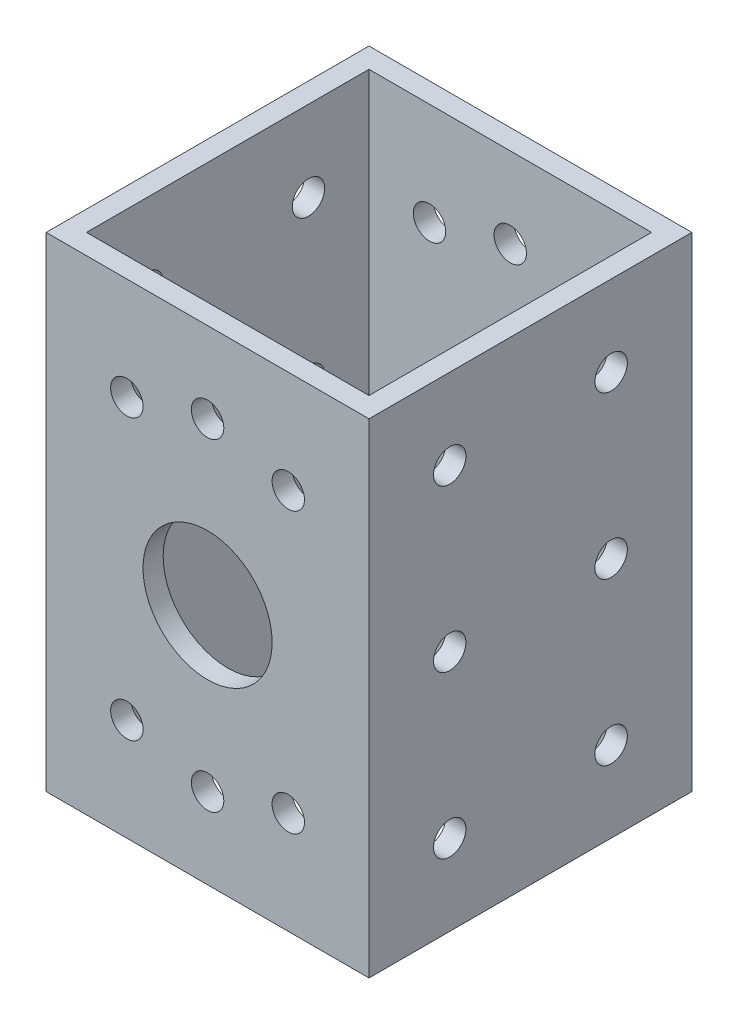
from build123d import *

# Parameters (mm, degrees)
SKETCH1_W            = 50.8
SKETCH1_H            = 50.8
SKETCH1_W_2          = 44.45
SKETCH1_H_2          = 44.45
BOSS_EXTRUDE1_DEPTH  = 76.2
SKETCH3_R            = 2.5527
CUT_EXTRUDE1_DEPTH   = 50.8
CIRPATTERN1_COUNT    = 12
SKETCH4_R            = 10.16
CUT_EXTRUDE2_DEPTH   = 50.8
SKETCH5_R            = 2.5527
CUT_EXTRUDE3_DEPTH   = 50.8
LPATTERN1_COUNT      = 3
LPATTERN1_PITCH      = 25.4
LPATTERN1_COUNT_DIR2 = 2
LPATTERN1_PITCH_DIR2 = 25.4


with BuildPart() as part:
    # Sketch1 → Boss-Extrude1 (new body)
    with BuildSketch(Plane(origin=(0, 0, 0), x_dir=(1, 0, 0), z_dir=(0, 1, 0))):
        Rectangle(SKETCH1_W, SKETCH1_H)
        Rectangle(SKETCH1_W_2, SKETCH1_H_2, mode=Mode.SUBTRACT)
    extrude(amount=BOSS_EXTRUDE1_DEPTH)

    # Sketch3 → Cut-Extrude1 (cut)
    with BuildSketch(Plane.XY.offset(25.4)):
        with Locations((0, 12.7)):
            Circle(SKETCH3_R)
    cut_extrude1 = extrude(amount=-CUT_EXTRUDE1_DEPTH, mode=Mode.SUBTRACT)

    # CirPattern1: Cut-Extrude1 ×12 about axis, 6 skipped
    cirpattern1_axis = Axis((0, 38.1, 25.4), (0, 0, 1))
    add([cut_extrude1.rotate(cirpattern1_axis, i * 360 / CIRPATTERN1_COUNT) for i in range(1, CIRPATTERN1_COUNT) if i not in (2, 3, 4, 8, 9, 10)], mode=Mode.SUBTRACT)

    # Sketch4 → Cut-Extrude2 (cut)
    with BuildSketch(Plane.XY.offset(25.4)):
        with Locations((0, 38.1)):
            Circle(SKETCH4_R)
    extrude(amount=-CUT_EXTRUDE2_DEPTH, mode=Mode.SUBTRACT)

    # Sketch5 → Cut-Extrude3 (cut)
    with BuildSketch(Plane.ZY.offset(25.4)):
        with Locations((-12.7, 12.7)):
            Circle(SKETCH5_R)
    cut_extrude3 = extrude(amount=-CUT_EXTRUDE3_DEPTH, mode=Mode.SUBTRACT)

    # LPattern1: Cut-Extrude3 3 × 2
    with Locations(*[(0, i * LPATTERN1_PITCH, j * LPATTERN1_PITCH_DIR2) for i in range(LPATTERN1_COUNT) for j in range(LPATTERN1_COUNT_DIR2) if (i, j) != (0, 0)]):
        add(cut_extrude3, mode=Mode.SUBTRACT)


solid = part.part
